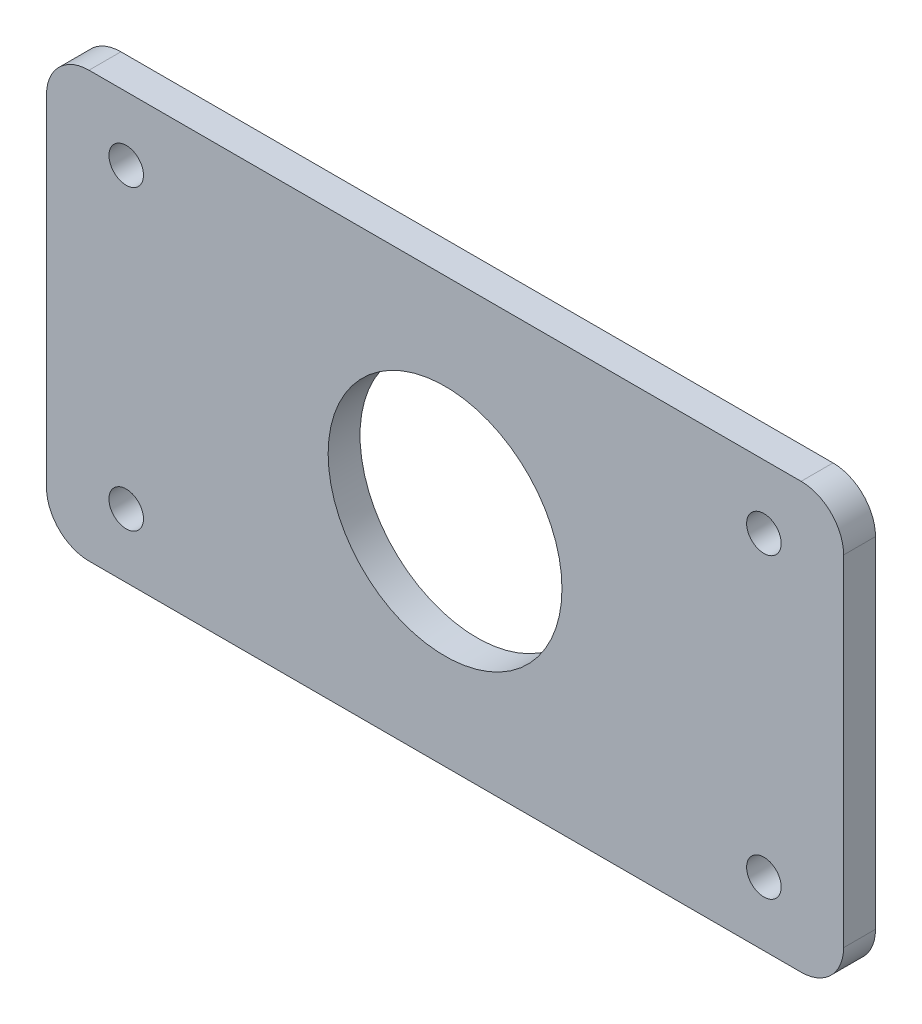
from build123d import *

# Parameters (mm, degrees)
SKETCH2_W               = 150
SKETCH2_H               = 80
BOSS_EXTRUDE1_DEPTH     = 3
CUT_EXTRUDE1_DEPTH      = 86.211501571
CUT_EXTRUDE1_DEPTH_BACK = 86.211501571
SKETCH3_R               = 3.25
SKETCH3_R_2             = 22
FILLET2_R               = 8


with BuildPart() as part:
    # Sketch2 → Boss-Extrude1 (new, symmetric)
    with BuildSketch(Plane.XY):
        Rectangle(SKETCH2_W, SKETCH2_H)
    extrude(amount=BOSS_EXTRUDE1_DEPTH, both=True)

    # Sketch3 → Cut-Extrude1 (cut, two sides: drawn at the far end of the back side and taken through both)
    with BuildSketch(Plane.XY.offset(3).offset(-CUT_EXTRUDE1_DEPTH_BACK)):
        with Locations((-60, 28)):
            Circle(SKETCH3_R)
        with Locations((-60, -28)):
            Circle(SKETCH3_R)
        with Locations((60, -28)):
            Circle(SKETCH3_R)
        with Locations((60, 28)):
            Circle(SKETCH3_R)
        Circle(SKETCH3_R_2)
    extrude(amount=CUT_EXTRUDE1_DEPTH + CUT_EXTRUDE1_DEPTH_BACK, mode=Mode.SUBTRACT)

    # Fillet2
    fillet2_edges = [part.edges().sort_by_distance(p)[0] for p in [
        (75, -40, 0),
        (-75, -40, 0),
        (-75, 40, 0),
        (75, 40, 0),
    ]]
    fillet(fillet2_edges, radius=FILLET2_R)


solid = part.part
